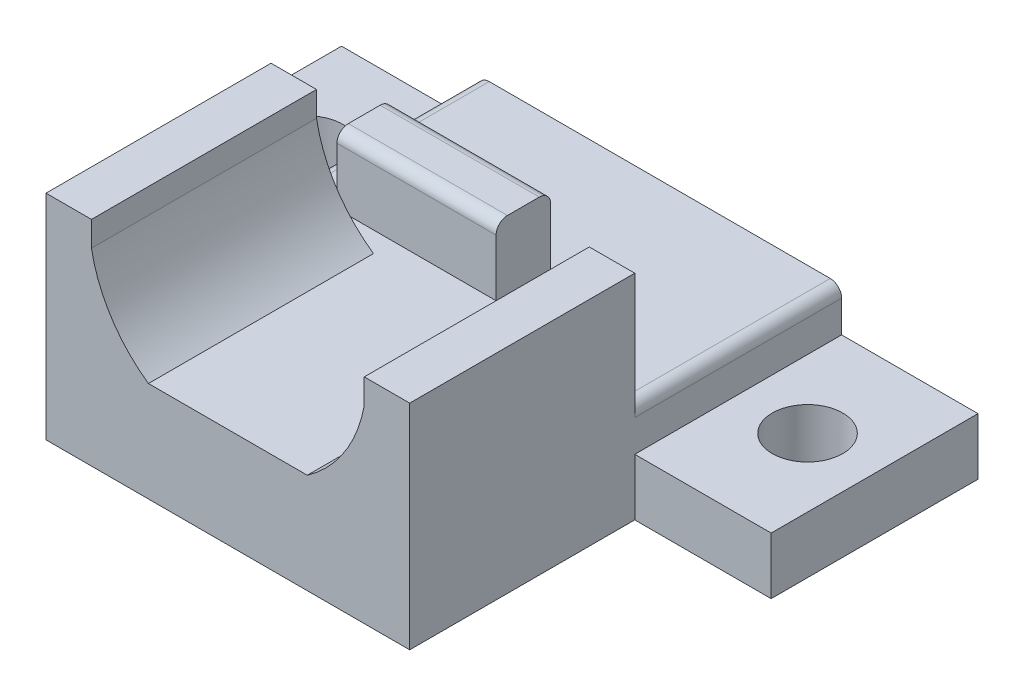
from build123d import *

# Parameters (mm, degrees)
SKETCH2_W                = 16
SKETCH2_H                = 19
BOSS_EXTRUDE1_DEPTH      = 13.3
SKETCH3_W                = 12
SKETCH3_H                = 19
CUT_EXTRUDE1_DEPTH       = 8.9
CUT_EXTRUDE2_DEPTH       = 19.19725254
CUT_EXTRUDE2_DEPTH_BACK  = 19.19725254
SKETCH4_W                = 9.9
SKETCH4_H                = 3.9
SKETCH6_W                = 14
SKETCH6_H                = 9.1
BOSS_EXTRUDE2_DEPTH      = 2.5
CUT_EXTRUDE4_DEPTH       = 21.072119968
CUT_EXTRUDE4_DEPTH_BACK  = 21.072119968
SKETCH7_R                = 1.55
BOSS_EXTRUDE3_DEPTH      = 9.5
BOSS_EXTRUDE3_DEPTH_BACK = 9.1
SKETCH14_W               = 12
SKETCH14_H               = 8.9
CUT_EXTRUDE9_DEPTH       = 22.520687721
CUT_EXTRUDE9_DEPTH_BACK  = 22.520687721
FILLET4_R                = 0.9
SKETCH16_W               = 16.145602647
SKETCH16_H               = 8.9
CUT_EXTRUDE10_DEPTH      = 9.1
SKETCH17_W               = 7
SKETCH17_H               = 2.4
BOSS_EXTRUDE4_DEPTH      = 3
FILLET6_R                = 0.5
FILLET7_R                = 0.5
FILLET8_R                = 0.5


with BuildPart() as part:
    # Sketch2 → Boss-Extrude1 (new body)
    with BuildSketch(Plane(origin=(0, 0, 0), x_dir=(1, 0, 0), z_dir=(0, 1, 0))):
        Rectangle(SKETCH2_W, SKETCH2_H)
    extrude(amount=BOSS_EXTRUDE1_DEPTH)

    # Sketch3 → Cut-Extrude1 (cut)
    with BuildSketch(Plane(origin=(0, 13.3, 0), x_dir=(1, 0, 0), z_dir=(0, 1, 0))):
        Rectangle(SKETCH3_W, SKETCH3_H)
    extrude(amount=-CUT_EXTRUDE1_DEPTH, mode=Mode.SUBTRACT)

    # Sketch4 → Cut-Extrude2 (cut, two sides: drawn at the far end of the back side and taken through both)
    with BuildSketch(Plane(origin=(0, 0, 0), x_dir=(0, 0, -1), z_dir=(1, 0, 0)).offset(-CUT_EXTRUDE2_DEPTH_BACK)):
        with Locations((-4.55, 11.35)):
            Rectangle(SKETCH4_W, SKETCH4_H)
    extrude(amount=CUT_EXTRUDE2_DEPTH + CUT_EXTRUDE2_DEPTH_BACK, mode=Mode.SUBTRACT)

    # Sketch6 → Boss-Extrude2 (add)
    with BuildSketch(Plane(origin=(0, 0, 0), x_dir=(1, 0, 0), z_dir=(0, 1, 0))):
        with Locations((7, 4.95)):
            Rectangle(SKETCH6_W, SKETCH6_H)
        with Locations((-7, 4.95)):
            Rectangle(SKETCH6_W, SKETCH6_H)
    extrude(amount=BOSS_EXTRUDE2_DEPTH)

    # Sketch7 → Cut-Extrude4 (cut, two sides: drawn at the far end of the back side and taken through both)
    with BuildSketch(Plane(origin=(0, 2.5, 0), x_dir=(1, 0, 0), z_dir=(0, 1, 0)).offset(-CUT_EXTRUDE4_DEPTH_BACK)):
        with Locations(Location((-11, 5, 0), (0, 0, 270))):
            Circle(SKETCH7_R)
        with Locations(Location((11, 5, 0), (0, 0, 270))):
            Circle(SKETCH7_R)
    extrude(amount=CUT_EXTRUDE4_DEPTH + CUT_EXTRUDE4_DEPTH_BACK, mode=Mode.SUBTRACT)

    # Sketch14 → Boss-Extrude3 (add, two sides: drawn at the far end of the back side and taken through both)
    with BuildSketch(Plane.XY.offset(-BOSS_EXTRUDE3_DEPTH_BACK)):
        with Locations((0, 8.85)):
            Rectangle(SKETCH14_W, SKETCH14_H)
    extrude(amount=BOSS_EXTRUDE3_DEPTH + BOSS_EXTRUDE3_DEPTH_BACK)

    # Sketch15 → Cut-Extrude9 (cut, two sides: drawn at the far end of the back side and taken through both)
    with BuildSketch(Plane.XY.offset(-CUT_EXTRUDE9_DEPTH_BACK)):
        with BuildLine():
            ThreePointArc((-6, 8.3), (-5.132040834, 6.102704612), (-3.494281042, 4.4))
            Line((-3.494281042, 4.4), (3.494281042, 4.4))
            ThreePointArc((3.494281042, 4.4), (5.132040834, 6.102704612), (6, 8.3))
            Line((6, 8.3), (6, 13.3))
            Line((6, 13.3), (-6, 13.3))
            Line((-6, 13.3), (-6, 8.3))
        make_face()
    extrude(amount=CUT_EXTRUDE9_DEPTH + CUT_EXTRUDE9_DEPTH_BACK, mode=Mode.SUBTRACT)

    # Fillet4
    fillet4_edges = [part.edges().sort_by_distance(p)[0] for p in [
        (-6, 4.4, -9.3),
        (6, 4.4, -9.3),
    ]]
    fillet(fillet4_edges, radius=FILLET4_R)

    # Sketch16 → Cut-Extrude10 (cut)
    with BuildSketch(Plane(origin=(0, 0, -9.5), x_dir=(-1, 0, 0), z_dir=(0, 0, -1))):
        with Locations((-0.072801324, 8.85)):
            Rectangle(SKETCH16_W, SKETCH16_H)
    extrude(amount=-CUT_EXTRUDE10_DEPTH, mode=Mode.SUBTRACT)

    # Sketch17 → Boss-Extrude4 (add)
    with BuildSketch(Plane(origin=(0, 4.4, 0), x_dir=(1, 0, 0), z_dir=(0, 1, 0))):
        with Locations((-2.5, 2.5)):
            Rectangle(SKETCH17_W, SKETCH17_H)
    extrude(amount=BOSS_EXTRUDE4_DEPTH)

    # Fillet6
    fillet6_edges = [part.edges().sort_by_distance(p)[0] for p in [
        (-2.5, 7.4, -3.7),
    ]]
    fillet(fillet6_edges, radius=FILLET6_R)

    # Fillet7
    fillet7_edges = [part.edges().sort_by_distance(p)[0] for p in [
        (-2.5, 7.4, -1.3),
    ]]
    fillet(fillet7_edges, radius=FILLET7_R)

    # Fillet8
    fillet8_edges = [part.edges().sort_by_distance(p)[0] for p in [
        (8, 4.4, -4.95),
        (-8, 4.4, -4.95),
    ]]
    fillet(fillet8_edges, radius=FILLET8_R)


solid = part.part
